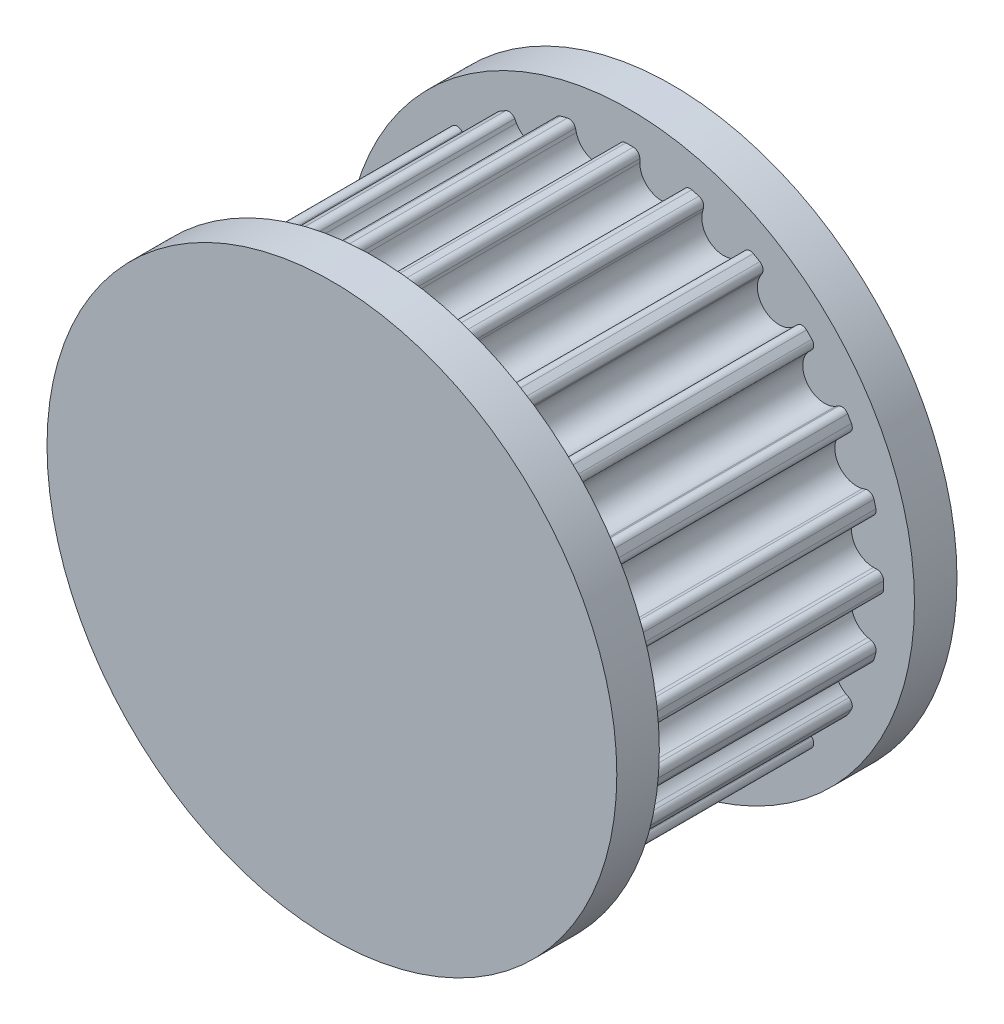
from build123d import *

# Parameters (mm, degrees)
SKETCH2_R         = 29.875
EXTRUDE1_DEPTH    = 30
EXTRUDE2_DEPTH    = 30
CIRPATTERN1_COUNT = 24
SKETCH3_R         = 33.5
EXTRUDE3_DEPTH    = 5
EXTRUDE4_START    = 5
SKETCH4_R         = 33.5
EXTRUDE4_DEPTH    = 5
SKETCH6_R         = 10
EXTRUDE5_DEPTH    = 30
CHAMFER1_SIZE     = 2


with BuildPart() as part:
    # Sketch2 → Extrude1 (new body)
    with BuildSketch(Plane.XY):
        Circle(SKETCH2_R)
    extrude(amount=EXTRUDE1_DEPTH)

    # Sketch1 → Extrude2 (cut)
    with BuildSketch(Plane.XY):
        with BuildLine():
            Line((-1.206491179, 29.085066823), (-1.202957444, 28.680140914))
            ThreePointArc((-1.202957444, 28.680140914), (-3.437407272, 26.109700424), (-6.260999022, 28.014237108))
            Line((-6.260999022, 28.014237108), (-6.362388233, 28.406280098))
            ThreePointArc((-6.362388233, 28.406280098), (-6.719671358, 28.881877013), (-7.308355692, 28.967284341))
            ThreePointArc((-7.308355692, 28.967284341), (-3.899469993, 29.619415234), (-0.437955362, 29.871789704))
            ThreePointArc((-0.437955362, 29.871789704), (-0.98447572, 29.636929843), (-1.206491179, 29.085066823))
        make_face()
    extrude2 = extrude(amount=EXTRUDE2_DEPTH, mode=Mode.SUBTRACT)

    # CirPattern1: Extrude2 ×24 about axis
    cirpattern1_axis = Axis((0, 0, 0), (0, 0, 1))
    for i in range(1, CIRPATTERN1_COUNT):
        add(extrude2.rotate(cirpattern1_axis, i * 360 / CIRPATTERN1_COUNT), mode=Mode.SUBTRACT)

    # Sketch3 → Extrude3 (add)
    with BuildSketch(Plane.XY.offset(30)):
        Circle(SKETCH3_R)
    extrude(amount=EXTRUDE3_DEPTH)

    # Sketch4 → Extrude4 (add)
    with BuildSketch(Plane(origin=(0, 0, 0), x_dir=(-1, 0, 0), z_dir=(0, 0, -1)).offset(EXTRUDE4_START)):
        with Locations(Location((0, 0, 0), (0, 0, 180))):
            Circle(SKETCH4_R)
    extrude(amount=-EXTRUDE4_DEPTH)

    # Sketch6 → Extrude5 (cut)
    with BuildSketch(Plane(origin=(0, 0, -5), x_dir=(-1, 0, 0), z_dir=(0, 0, -1))):
        Circle(SKETCH6_R)
    extrude(amount=-EXTRUDE5_DEPTH, mode=Mode.SUBTRACT)

    # Chamfer1
    chamfer1_edges = [part.edges().sort_by_distance(p)[0] for p in [
        (10, 0, -5),
    ]]
    chamfer(chamfer1_edges, length=CHAMFER1_SIZE)


solid = part.part
